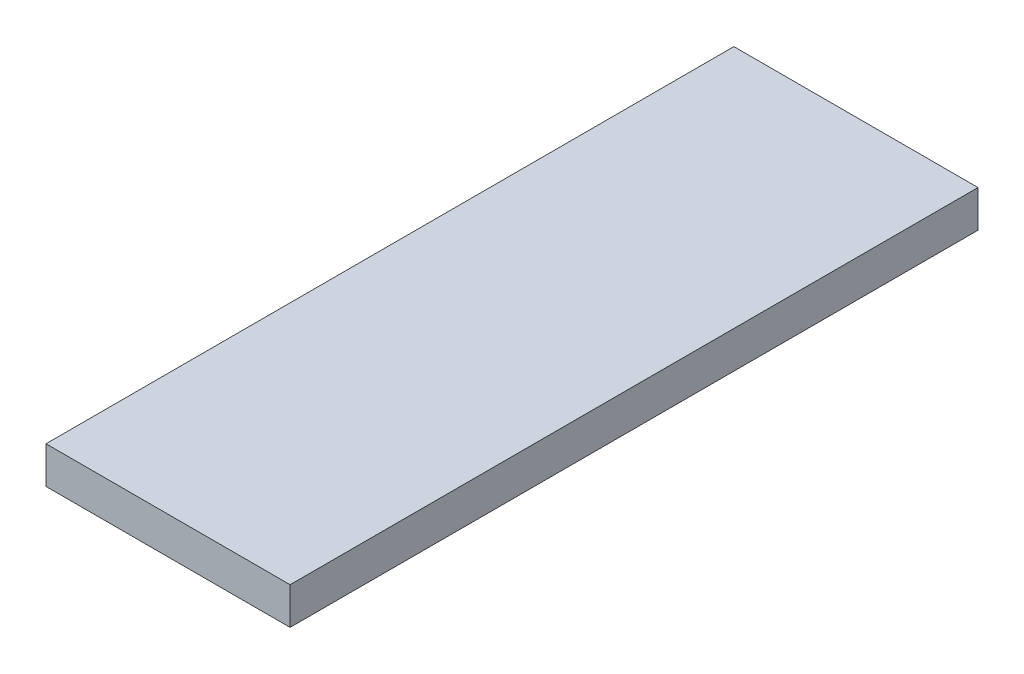
from build123d import *

# Parameters (mm, degrees)
ESBO_O1_W                = 33
ESBO_O1_H                = 5
RESSALTO_EXTRUS_O1_DEPTH = 93


with BuildPart() as part:
    # Esboço1 → Ressalto-extrusão1 (new body)
    with BuildSketch(Plane.XY):
        with Locations((-17.21618663, -15.711662851)):
            Rectangle(ESBO_O1_W, ESBO_O1_H)
    extrude(amount=RESSALTO_EXTRUS_O1_DEPTH)


solid = part.part
